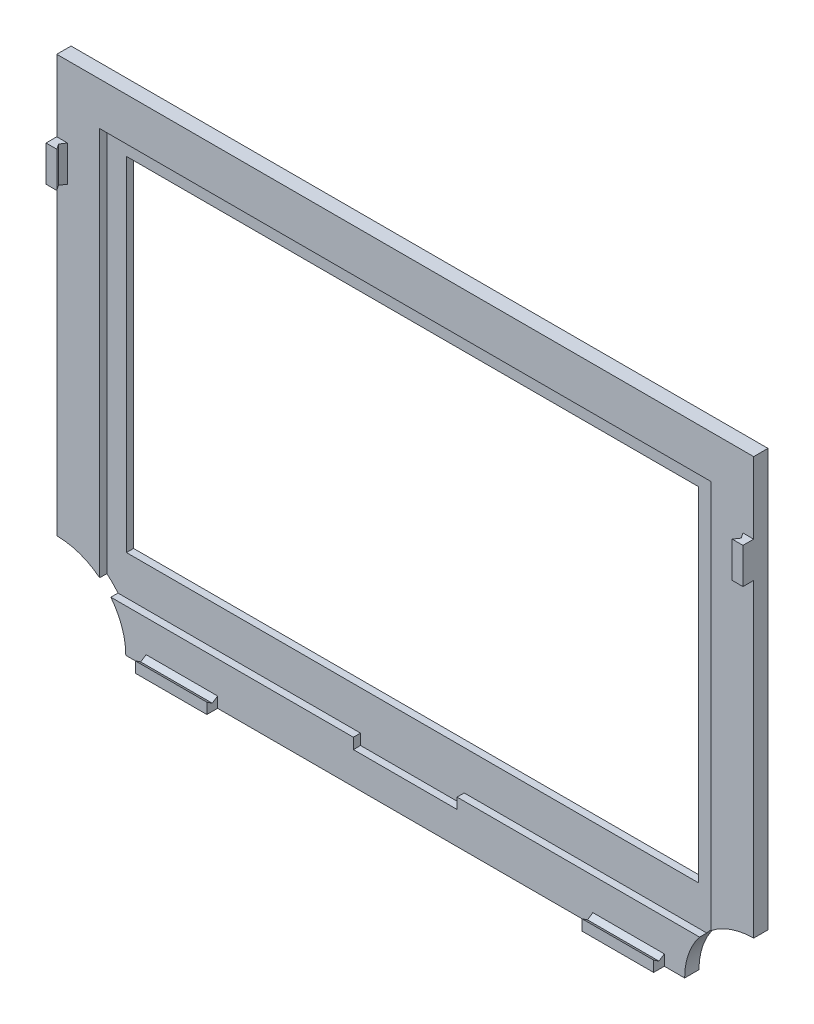
from build123d import *
from build123d.topology import SkipClean

# Parameters (mm, degrees)
SKETCH1_W               = 195
SKETCH1_H               = 136
SKETCH1_W_2             = 160
SKETCH1_H_2             = 96
BOSS_EXTRUDE1_DEPTH     = 2
SKETCH1_3_W             = 195
SKETCH1_3_H             = 136
BOSS_EXTRUDE2_DEPTH     = 2
CUT_EXTRUDE1_DEPTH      = 1.375
CUT_EXTRUDE1_DEPTH_BACK = 1.375
SKETCH2_R               = 3.25
SKETCH3_R               = 19.314272249
CUT_EXTRUDE2_DEPTH      = 119.938009064
SKETCH5_W               = 20
SKETCH5_H               = 3
SKETCH5_W_2             = 3
SKETCH5_H_2             = 10
BOSS_EXTRUDE3_DEPTH     = 3
CUT_EXTRUDE3_DEPTH      = 184.163861064
CUT_EXTRUDE4_DEPTH      = 152.615467549


with BuildPart() as part:
    # Sketch1 → Boss-Extrude1 (new body)
    with BuildSketch(Plane.XY):
        Rectangle(SKETCH1_W, SKETCH1_H)
        with Locations((0, 3)):
            Rectangle(SKETCH1_W_2, SKETCH1_H_2, mode=Mode.SUBTRACT)
    extrude(amount=-BOSS_EXTRUDE1_DEPTH)

    # Sketch1<3> → Boss-Extrude2 (add)
    with BuildSketch(Plane.XY):
        Rectangle(SKETCH1_3_W, SKETCH1_3_H)
        Polygon((85.5, 56), (85.5, -56), (14.5, -56), (14.5, -59), (-14.5, -59), (-14.5, -56), (-85.5, -56), (-85.5, 56), align=None, mode=Mode.SUBTRACT)
    extrude(amount=BOSS_EXTRUDE2_DEPTH)

    # Sketch2 → Cut-Extrude1 (cut, two sides: drawn at the far end of the back side and taken through both)
    with SkipClean():  # the faces are left unmerged after this step: merging them gives an invalid solid
        with BuildSketch(Plane.XY.offset(-CUT_EXTRUDE1_DEPTH_BACK)):
            with Locations((-90.5, 61)):
                Circle(SKETCH2_R)
            with Locations((90.5, 61)):
                Circle(SKETCH2_R)
            with Locations((90.5, -61)):
                Circle(SKETCH2_R)
            with Locations((-90.5, -61)):
                Circle(SKETCH2_R)
            with Locations((-30.166666667, -61)):
                Circle(SKETCH2_R)
            with Locations((30.166666667, -61)):
                Circle(SKETCH2_R)
            with Locations((90.5, 0)):
                Circle(SKETCH2_R)
            with Locations((-30.166666667, 61)):
                Circle(SKETCH2_R)
            with Locations((30.166666667, 61)):
                Circle(SKETCH2_R)
            with Locations((-90.5, 0)):
                Circle(SKETCH2_R)
        extrude(amount=CUT_EXTRUDE1_DEPTH + CUT_EXTRUDE1_DEPTH_BACK, mode=Mode.SUBTRACT)

    # Sketch3 → Cut-Extrude2 (cut, through all)
    with SkipClean():  # the faces are left unmerged after this step: merging them gives an invalid solid
        with BuildSketch(Plane(origin=(0, 0, -2), x_dir=(-1, 0, 0), z_dir=(0, 0, -1))):
            with Locations((97.5, -68)):
                Circle(SKETCH3_R)
        cut_extrude2 = extrude(amount=-CUT_EXTRUDE2_DEPTH, mode=Mode.SUBTRACT)

    # Mirror1: Cut-Extrude2 across plane
    with SkipClean():  # the faces are left unmerged after this step: merging them gives an invalid solid
        add(cut_extrude2.mirror(Plane(origin=(0, 0, 0), x_dir=(0, 0, 1), z_dir=(1, 0, 0))), mode=Mode.SUBTRACT)

    # Sketch5 → Boss-Extrude3 (add)
    with SkipClean():  # the faces are left unmerged after this step: merging them gives an invalid solid
        with BuildSketch(Plane.XY.offset(2)):
            with Locations((-62.5, -66.5)):
                Rectangle(SKETCH5_W, SKETCH5_H)
            with Locations((62.5, -66.5)):
                Rectangle(SKETCH5_W, SKETCH5_H)
            with Locations((-96, 43)):
                Rectangle(SKETCH5_W_2, SKETCH5_H_2)
            with Locations((96, 43)):
                Rectangle(SKETCH5_W_2, SKETCH5_H_2)
        extrude(amount=BOSS_EXTRUDE3_DEPTH)

    # Sketch6 → Cut-Extrude3 (cut, through all)
    with SkipClean():  # the faces are left unmerged after this step: merging them gives an invalid solid
        with BuildSketch(Plane(origin=(72.5, 0, 0), x_dir=(0, 0, -1), z_dir=(1, 0, 0))):
            Polygon((-3.5, -66), (-2, -65), (-5, -65), align=None)
        extrude(amount=-CUT_EXTRUDE3_DEPTH, mode=Mode.SUBTRACT)

    # Sketch7 → Cut-Extrude4 (cut, through all)
    with SkipClean():  # the faces are left unmerged after this step: merging them gives an invalid solid
        with BuildSketch(Plane(origin=(0, 48, 0), x_dir=(1, 0, 0), z_dir=(0, 1, 0))):
            Polygon((95.5, -3.5), (94.5, -2), (94.5, -5), align=None)
        cut_extrude4 = extrude(amount=-CUT_EXTRUDE4_DEPTH, mode=Mode.SUBTRACT)

    # Mirror2: Cut-Extrude4 across plane
    with SkipClean():  # the faces are left unmerged after this step: merging them gives an invalid solid
        add(cut_extrude4.mirror(Plane(origin=(0, 0, 0), x_dir=(0, 0, 1), z_dir=(1, 0, 0))), mode=Mode.SUBTRACT)


solid = part.part
